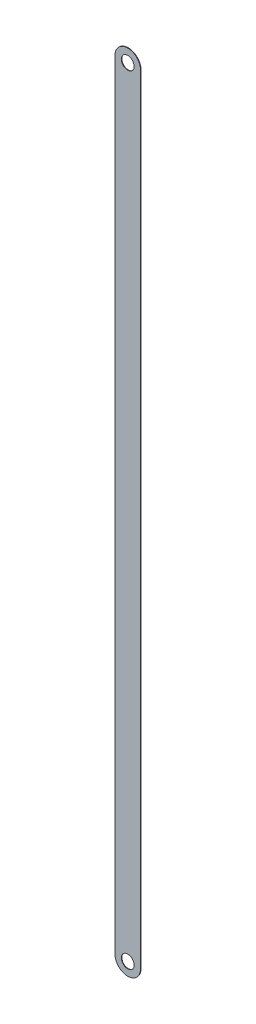
from build123d import *

# Parameters (mm, degrees)
SKETCH2_R           = 3.175
BOSS_EXTRUDE1_DEPTH = 0.254


with BuildPart() as part:
    # Sketch2 → Boss-Extrude1 (new body)
    with BuildSketch(Plane.XY):
        with BuildLine():
            Line((6.35, 386.08), (6.35, 0))
            ThreePointArc((6.35, 0), (0, -6.35), (-6.35, 0))
            Line((-6.35, 0), (-6.35, 386.08))
            ThreePointArc((-6.35, 386.08), (0, 392.43), (6.35, 386.08))
        make_face()
        with Locations((0, 386.08)):
            Circle(SKETCH2_R, mode=Mode.SUBTRACT)
        Circle(SKETCH2_R, mode=Mode.SUBTRACT)
    extrude(amount=BOSS_EXTRUDE1_DEPTH)


solid = part.part
